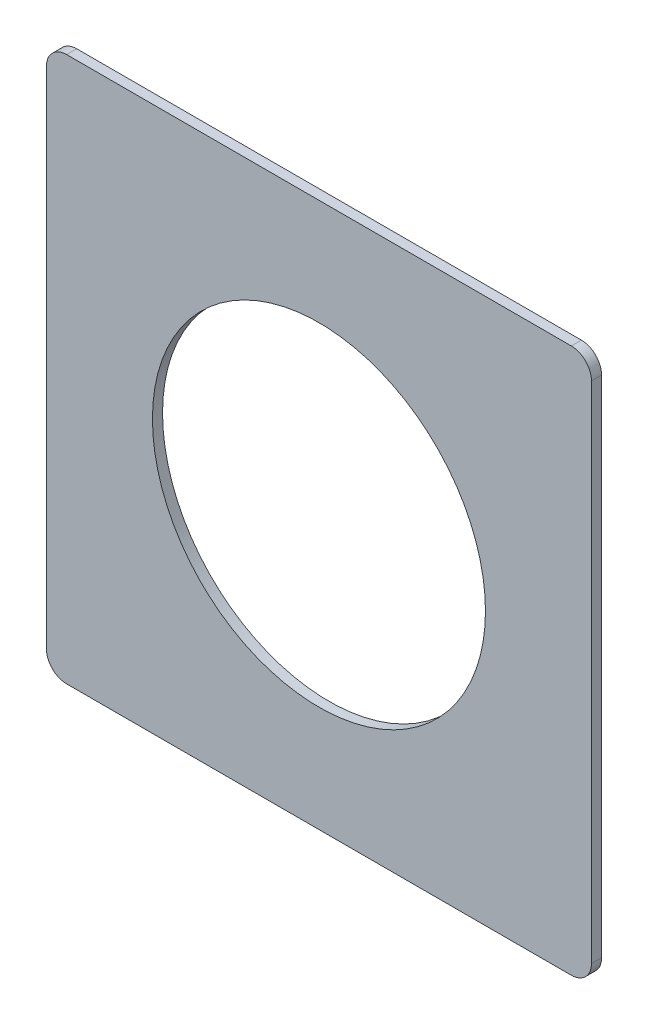
from build123d import *

# Parameters (mm, degrees)
BOSS_EXTRUDE1_DEPTH = 6.35
SKETCH2_R           = 104.764774547
CUT_EXTRUDE1_DEPTH  = 243.550051536


with BuildPart() as part:
    # Sketch1 → Boss-Extrude1 (new body)
    with BuildSketch(Plane.XY):
        with BuildLine():
            Line((-158.75, 171.45), (158.75, 171.45))
            ThreePointArc((158.75, 171.45), (167.730256121, 167.730256121), (171.45, 158.75))
            Line((171.45, 158.75), (171.45, -158.75))
            ThreePointArc((171.45, -158.75), (167.730256121, -167.730256121), (158.75, -171.45))
            Line((158.75, -171.45), (-158.75, -171.45))
            ThreePointArc((-158.75, -171.45), (-167.730256121, -167.730256121), (-171.45, -158.75))
            Line((-171.45, -158.75), (-171.45, 158.75))
            ThreePointArc((-171.45, 158.75), (-167.730256121, 167.730256121), (-158.75, 171.45))
        make_face()
    extrude(amount=BOSS_EXTRUDE1_DEPTH)

    # Sketch2 → Cut-Extrude1 (cut, through all)
    with BuildSketch(Plane.XY.offset(6.35)):
        Circle(SKETCH2_R)
    extrude(amount=-CUT_EXTRUDE1_DEPTH, mode=Mode.SUBTRACT)


solid = part.part
